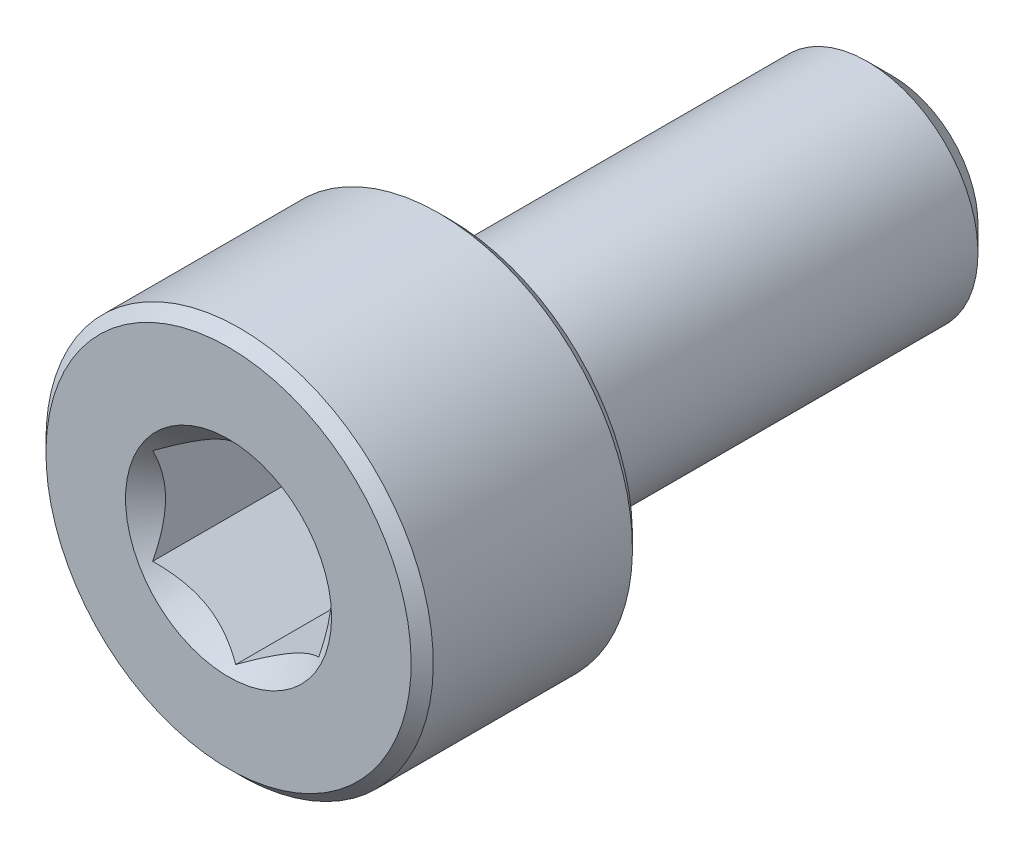
from build123d import *

# Parameters (mm, degrees)
CUT_EXTRUDE1_DEPTH = 3


with BuildPart() as part:
    # Sketch2 → Revolve1 (revolve)
    with BuildSketch(Plane(origin=(0, 0, 0), x_dir=(0, 0, -1), z_dir=(1, 0, 0))):
        with BuildLine():
            Line((-6, 0), (-6, 3.3))
            Line((-6, 3.3), (-5.8, 3.5))
            Line((-5.8, 3.5), (-2.2, 3.5))
            Line((-2.2, 3.5), (-2, 3.3))
            Line((-2, 3.3), (-2, 2.2))
            ThreePointArc((-2, 2.2), (-1.941421356, 2.058578644), (-1.8, 2))
            Line((-1.8, 2), (5.545336663, 2))
            Line((5.545336663, 2), (6, 1.545336663))
            Line((6, 1.545336663), (6, 0))
            Line((6, 0), (-6, 0))
        make_face()
    revolve(axis=Axis((0, 0, -6), (0, 0, 1)))

    # Sketch3 → Cut-Extrude1 (cut)
    with BuildSketch(Plane.XY.offset(6)):
        Polygon((1.5, -0.866025404), (1.5, 0.866025404), (0, 1.732050808), (-1.5, 0.866025404), (-1.5, -0.866025404), (0, -1.732050808), align=None)
    extrude(amount=-CUT_EXTRUDE1_DEPTH, mode=Mode.SUBTRACT)

    # Cut-Extrude2 cone 1 section (through the dimple's axis) → Cut-Extrude2 (revolve, cut)
    with BuildSketch(Plane(origin=(0, 0, 6), x_dir=(0, -1, 0), z_dir=(1, 0, 0))):
        Polygon((0, 0), (1.861954618, 0), (0, 1.861954618), align=None)
    revolve(axis=Axis((0, 0, 6), (0, 0, -1)), mode=Mode.SUBTRACT)


solid = part.part
